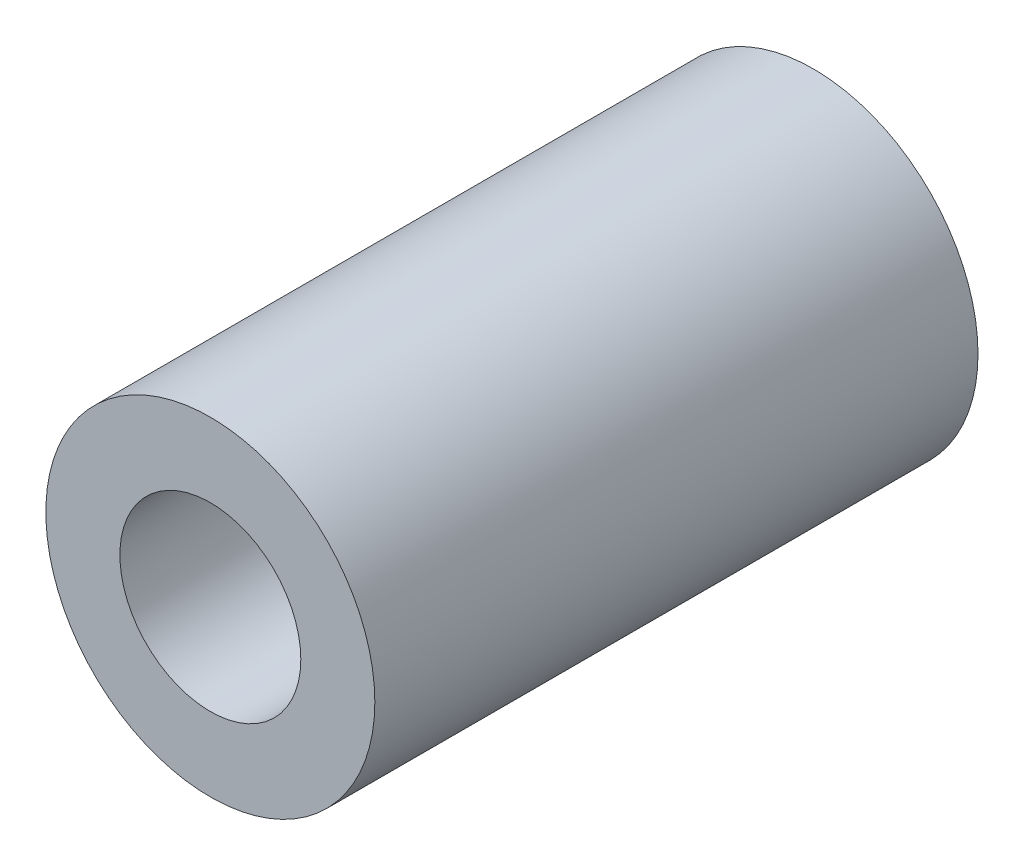
from build123d import *

# Parameters (mm, degrees)
SKETCH_3_R          = 3
SKETCH_3_R_2        = 1.65
EXTRUDE_28884_DEPTH = 11


with BuildPart() as part:
    # Sketch 3 → Extrude 28884 (new body)
    with BuildSketch(Plane.XY):
        Circle(SKETCH_3_R)
        Circle(SKETCH_3_R_2, mode=Mode.SUBTRACT)
    extrude(amount=EXTRUDE_28884_DEPTH)


solid = part.part
